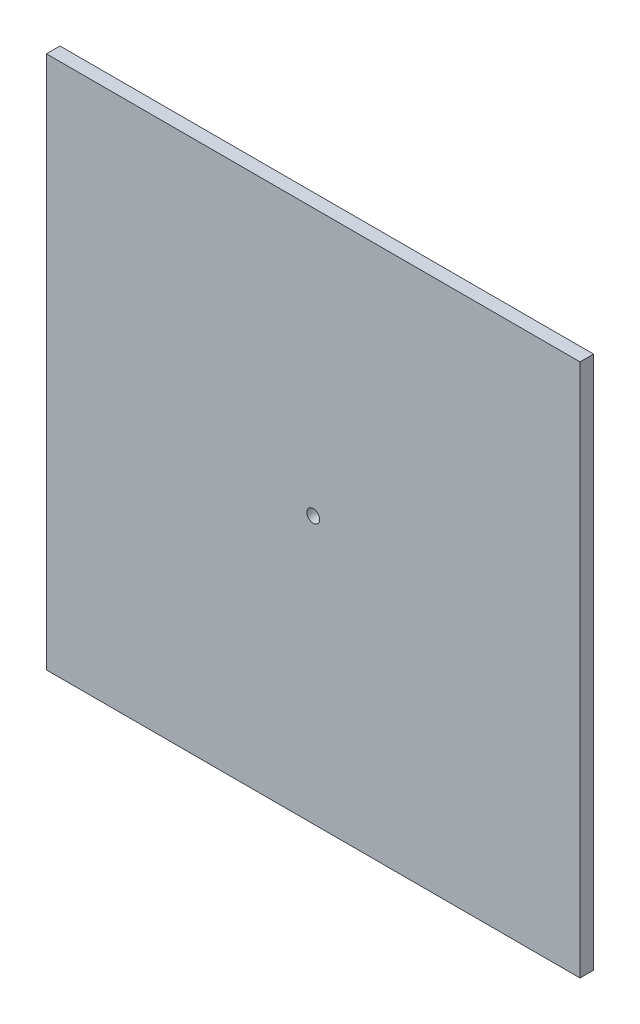
from build123d import *

# Parameters (mm, degrees)
SKETCH1_W           = 500
SKETCH1_H           = 500
BOSS_EXTRUDE1_DEPTH = 12.7
SKETCH4_R           = 6
CUT_EXTRUDE1_DEPTH  = 12.7


with BuildPart() as part:
    # Sketch1 → Boss-Extrude1 (new body)
    with BuildSketch(Plane.XY):
        Rectangle(SKETCH1_W, SKETCH1_H)
    extrude(amount=BOSS_EXTRUDE1_DEPTH)

    # Sketch4 → Cut-Extrude1 (cut)
    with BuildSketch(Plane.XY.offset(12.7)):
        Circle(SKETCH4_R)
    extrude(amount=-CUT_EXTRUDE1_DEPTH, mode=Mode.SUBTRACT)


solid = part.part
